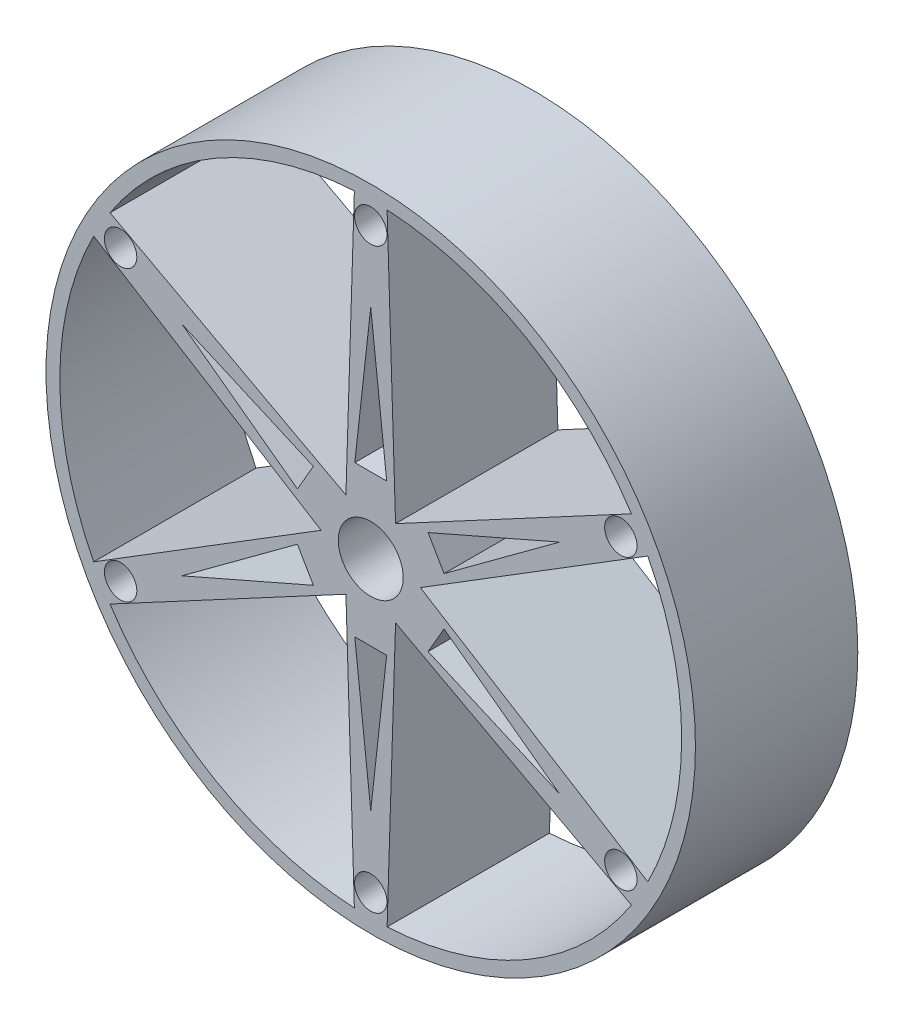
from build123d import *

# Parameters (mm, degrees)
SKETCH1_R           = 0.14979499
BOSS_EXTRUDE1_DEPTH = 1.5


with BuildPart() as part:
    # Sketch1 → Boss-Extrude1 (new body)
    # profile 1 of 26: a face of its own
    with BuildSketch(Plane.XY):
        with BuildLine():
            Line((-0.151247724, 2.868610652), (-0.147216387, 2.996385712))
            ThreePointArc((-0.147216387, 2.996385712), (-1.5, 2.598076211), (-2.521337953, 1.625685987))
            Line((-2.521337953, 1.625685987), (-2.408665836, 1.565289697))
            ThreePointArc((-2.408665836, 1.565289697), (-1.436297579, 2.487740382), (-0.151247724, 2.868610652))
        make_face()
    # profile 2 of 26: a face of its own
    with BuildSketch(Plane.XY):
        with BuildLine():
            Line((0, 2.872595159), (0, 3))
            ThreePointArc((0, 3), (-0.073630374, 2.999096292), (-0.147216387, 2.996385712))
            Line((-0.147216387, 2.996385712), (-0.151247724, 2.868610652))
            ThreePointArc((-0.151247724, 2.868610652), (-0.0756501, 2.871598859), (0, 2.872595159))
        make_face()
    # profile 3 of 26: a face of its own
    with BuildSketch(Plane.XY):
        with BuildLine():
            ThreePointArc((0.147216387, 2.996385712), (0.073630374, 2.999096292), (0, 3))
            Line((0, 3), (0, 2.872595159))
            ThreePointArc((0, 2.872595159), (0.0756501, 2.871598859), (0.151247724, 2.868610652))
            Line((0.151247724, 2.868610652), (0.147216387, 2.996385712))
        make_face()
    # profile 4 of 26: a face of its own
    with BuildSketch(Plane.XY):
        with BuildLine():
            ThreePointArc((2.521337953, 1.625685987), (1.5, 2.598076211), (0.147216387, 2.996385712))
            Line((0.147216387, 2.996385712), (0.151247724, 2.868610652))
            ThreePointArc((0.151247724, 2.868610652), (1.436297579, 2.487740382), (2.408665836, 1.565289697))
            Line((2.408665836, 1.565289697), (2.521337953, 1.625685987))
        make_face()
    # profile 5 of 26: a face of its own
    with BuildSketch(Plane.XY):
        with BuildLine():
            ThreePointArc((0.147216387, -2.996385712), (1.5, -2.598076211), (2.521337953, -1.625685987))
            Line((2.521337953, -1.625685987), (2.408665836, -1.565289697))
            ThreePointArc((2.408665836, -1.565289697), (1.436297579, -2.487740382), (0.151247724, -2.868610652))
            Line((0.151247724, -2.868610652), (0.147216387, -2.996385712))
        make_face()
    # profile 6 of 26: a face of its own
    with BuildSketch(Plane.XY):
        with BuildLine():
            ThreePointArc((2.521337953, -1.625685987), (2.598076211, -1.5), (2.66855434, -1.370699725))
            Line((2.66855434, -1.370699725), (2.55991356, -1.303320955))
            ThreePointArc((2.55991356, -1.303320955), (2.487740382, -1.436297579), (2.408665836, -1.565289697))
            Line((2.408665836, -1.565289697), (2.521337953, -1.625685987))
        make_face()
    # profile 7 of 26: a face of its own
    with BuildSketch(Plane.XY):
        with BuildLine():
            ThreePointArc((3, 0), (2.915961507, 0.705101759), (2.66855434, 1.370699725))
            Line((2.66855434, 1.370699725), (2.55991356, 1.303320955))
            ThreePointArc((2.55991356, 1.303320955), (2.793331187, 0.67015209), (2.872595159, 0))
            ThreePointArc((2.872595159, 0), (2.793331187, -0.67015209), (2.55991356, -1.303320955))
            Line((2.55991356, -1.303320955), (2.66855434, -1.370699725))
            ThreePointArc((2.66855434, -1.370699725), (2.915961507, -0.705101759), (3, 0))
        make_face()
    # profile 8 of 26: a face of its own
    with BuildSketch(Plane.XY):
        with BuildLine():
            Line((-2.408665836, -1.565289697), (-2.521337953, -1.625685987))
            ThreePointArc((-2.521337953, -1.625685987), (-1.5, -2.598076211), (-0.147216387, -2.996385712))
            Line((-0.147216387, -2.996385712), (-0.151247724, -2.868610652))
            ThreePointArc((-0.151247724, -2.868610652), (-1.436297579, -2.487740382), (-2.408665836, -1.565289697))
        make_face()
    # profile 9 of 26: a face of its own
    with BuildSketch(Plane.XY):
        with BuildLine():
            Line((-0.151247724, -2.868610652), (-0.147216387, -2.996385712))
            ThreePointArc((-0.147216387, -2.996385712), (0, -3), (0.147216387, -2.996385712))
            Line((0.147216387, -2.996385712), (0.151247724, -2.868610652))
            ThreePointArc((0.151247724, -2.868610652), (0, -2.872595159), (-0.151247724, -2.868610652))
        make_face()
    # profile 10 of 26: a face of its own
    with BuildSketch(Plane.XY):
        with BuildLine():
            Line((-2.55991356, -1.303320955), (-2.66855434, -1.370699725))
            ThreePointArc((-2.66855434, -1.370699725), (-2.598076211, -1.5), (-2.521337953, -1.625685987))
            Line((-2.521337953, -1.625685987), (-2.408665836, -1.565289697))
            ThreePointArc((-2.408665836, -1.565289697), (-2.487740382, -1.436297579), (-2.55991356, -1.303320955))
        make_face()
    # profile 11 of 26: a face of its own
    with BuildSketch(Plane.XY):
        with BuildLine():
            Line((-2.55991356, 1.303320955), (-2.66855434, 1.370699725))
            ThreePointArc((-2.66855434, 1.370699725), (-3, 0), (-2.66855434, -1.370699725))
            Line((-2.66855434, -1.370699725), (-2.55991356, -1.303320955))
            ThreePointArc((-2.55991356, -1.303320955), (-2.872595159, 0), (-2.55991356, 1.303320955))
        make_face()
    # profile 12 of 26: a face of its own
    with BuildSketch(Plane.XY):
        with BuildLine():
            ThreePointArc((2.66855434, 1.370699725), (2.598076211, 1.5), (2.521337953, 1.625685987))
            Line((2.521337953, 1.625685987), (2.408665836, 1.565289697))
            ThreePointArc((2.408665836, 1.565289697), (2.487740382, 1.436297579), (2.55991356, 1.303320955))
            Line((2.55991356, 1.303320955), (2.66855434, 1.370699725))
        make_face()
    # profile 13 of 26: a face of its own
    with BuildSketch(Plane.XY):
        with BuildLine():
            Line((-2.408665836, 1.565289697), (-2.521337953, 1.625685987))
            ThreePointArc((-2.521337953, 1.625685987), (-2.598076211, 1.5), (-2.66855434, 1.370699725))
            Line((-2.66855434, 1.370699725), (-2.55991356, 1.303320955))
            ThreePointArc((-2.55991356, 1.303320955), (-2.487740382, 1.436297579), (-2.408665836, 1.565289697))
        make_face()
    # profile 14 of 26: a face of its own
    with BuildSketch(Plane.XY):
        with BuildLine():
            Line((-0.235905833, 0.185333316), (-0.229226676, 0.397032249))
            Line((-0.229226676, 0.397032249), (-2.408665836, 1.565289697))
            ThreePointArc((-2.408665836, 1.565289697), (-2.487740382, 1.436297579), (-2.55991356, 1.303320955))
            Line((-2.55991356, 1.303320955), (-0.458453352, 0))
            Line((-0.458453352, 0), (-0.278456276, 0.111633786))
            ThreePointArc((-0.278456276, 0.111633786), (-0.259807621, 0.15), (-0.235905833, 0.185333316))
        make_face()
        with Locations((-2.31088182, 1.334188241)):
            Circle(SKETCH1_R, mode=Mode.SUBTRACT)
        Polygon((-0.530042873, 0.476011237), (-0.677259261, 0.221024975), (-1.744995763, 1.007473773), align=None, mode=Mode.SUBTRACT)
    # profile 15 of 26: a face of its own
    with BuildSketch(Plane.XY):
        with BuildLine():
            Line((-0.278456276, -0.111633786), (-0.458453352, 0))
            Line((-0.458453352, 0), (-2.55991356, -1.303320955))
            ThreePointArc((-2.55991356, -1.303320955), (-2.487740382, -1.436297579), (-2.408665836, -1.565289697))
            Line((-2.408665836, -1.565289697), (-0.229226676, -0.397032249))
            Line((-0.229226676, -0.397032249), (-0.235905833, -0.185333316))
            ThreePointArc((-0.235905833, -0.185333316), (-0.259807621, -0.15), (-0.278456276, -0.111633786))
        make_face()
        with Locations((-2.31088182, -1.334188241)):
            Circle(SKETCH1_R, mode=Mode.SUBTRACT)
        Polygon((-0.677259261, -0.221024975), (-0.530042873, -0.476011237), (-1.744995763, -1.007473773), align=None, mode=Mode.SUBTRACT)
    # profile 16 of 26: a face of its own
    with BuildSketch(Plane.XY):
        with BuildLine():
            ThreePointArc((-0.278456276, -0.111633786), (-0.3, 0), (-0.278456276, 0.111633786))
            Line((-0.278456276, 0.111633786), (-0.458453352, 0))
            Line((-0.458453352, 0), (-0.278456276, -0.111633786))
        make_face()
    # profile 17 of 26: a face of its own
    with BuildSketch(Plane.XY):
        with BuildLine():
            Line((-0.042550443, 0.296967102), (-0.229226676, 0.397032249))
            Line((-0.229226676, 0.397032249), (-0.235905833, 0.185333316))
            ThreePointArc((-0.235905833, 0.185333316), (-0.15, 0.259807621), (-0.042550443, 0.296967102))
        make_face()
    # profile 18 of 26: a face of its own
    with BuildSketch(Plane.XY):
        with BuildLine():
            ThreePointArc((0.151247724, 2.868610652), (0.0756501, 2.871598859), (0, 2.872595159))
            Line((0, 2.872595159), (0, 2.818171471))
            ThreePointArc((0, 2.818171471), (0.105921053, 2.774297535), (0.14979499, 2.668376482))
            ThreePointArc((0.14979499, 2.668376482), (0.105921053, 2.562455429), (0, 2.518581492))
            Line((0, 2.518581492), (0, 2.014947547))
            Line((0, 2.014947547), (0.147216387, 0.697036212))
            Line((0.147216387, 0.697036212), (0, 0.697036212))
            Line((0, 0.697036212), (0, 0.3))
            ThreePointArc((0, 0.3), (0.021329198, 0.299240815), (0.042550443, 0.296967102))
            Line((0.042550443, 0.296967102), (0.229226676, 0.397032249))
            Line((0.229226676, 0.397032249), (0.151247724, 2.868610652))
        make_face()
    # profile 19 of 26: a face of its own
    with BuildSketch(Plane.XY):
        with BuildLine():
            Line((0, 2.818171471), (0, 2.872595159))
            ThreePointArc((0, 2.872595159), (-0.0756501, 2.871598859), (-0.151247724, 2.868610652))
            Line((-0.151247724, 2.868610652), (-0.229226676, 0.397032249))
            Line((-0.229226676, 0.397032249), (-0.042550443, 0.296967102))
            ThreePointArc((-0.042550443, 0.296967102), (-0.021329198, 0.299240815), (0, 0.3))
            Line((0, 0.3), (0, 0.697036212))
            Line((0, 0.697036212), (-0.147216387, 0.697036212))
            Line((-0.147216387, 0.697036212), (0, 2.014947547))
            Line((0, 2.014947547), (0, 2.518581492))
            ThreePointArc((0, 2.518581492), (-0.14979499, 2.668376482), (0, 2.818171471))
        make_face()
    # profile 20 of 26: a face of its own
    with BuildSketch(Plane.XY):
        with BuildLine():
            Line((0.235905833, 0.185333316), (0.229226676, 0.397032249))
            Line((0.229226676, 0.397032249), (0.042550443, 0.296967102))
            ThreePointArc((0.042550443, 0.296967102), (0.15, 0.259807621), (0.235905833, 0.185333316))
        make_face()
    # profile 21 of 26: a face of its own
    with BuildSketch(Plane.XY):
        with BuildLine():
            Line((2.408665836, 1.565289697), (0.229226676, 0.397032249))
            Line((0.229226676, 0.397032249), (0.235905833, 0.185333316))
            ThreePointArc((0.235905833, 0.185333316), (0.259807621, 0.15), (0.278456276, 0.111633786))
            Line((0.278456276, 0.111633786), (0.458453352, 0))
            Line((0.458453352, 0), (2.55991356, 1.303320955))
            ThreePointArc((2.55991356, 1.303320955), (2.487740382, 1.436297579), (2.408665836, 1.565289697))
        make_face()
        Polygon((0.677259261, 0.221024975), (0.530042873, 0.476011237), (1.744995763, 1.007473773), align=None, mode=Mode.SUBTRACT)
        with Locations((2.31088182, 1.334188241)):
            Circle(SKETCH1_R, mode=Mode.SUBTRACT)
    # profile 22 of 26: a face of its own
    with BuildSketch(Plane.XY):
        with BuildLine():
            Line((0.458453352, 0), (0.278456276, 0.111633786))
            ThreePointArc((0.278456276, 0.111633786), (0.294564834, 0.056846799), (0.3, 0))
            ThreePointArc((0.3, 0), (0.294564834, -0.056846799), (0.278456276, -0.111633786))
            Line((0.278456276, -0.111633786), (0.458453352, 0))
        make_face()
    # profile 23 of 26: a face of its own
    with BuildSketch(Plane.XY):
        with BuildLine():
            Line((2.55991356, -1.303320955), (0.458453352, 0))
            Line((0.458453352, 0), (0.278456276, -0.111633786))
            ThreePointArc((0.278456276, -0.111633786), (0.259807621, -0.15), (0.235905833, -0.185333316))
            Line((0.235905833, -0.185333316), (0.229226676, -0.397032249))
            Line((0.229226676, -0.397032249), (2.408665836, -1.565289697))
            ThreePointArc((2.408665836, -1.565289697), (2.487740382, -1.436297579), (2.55991356, -1.303320955))
        make_face()
        Polygon((0.530042873, -0.476011237), (0.677259261, -0.221024975), (1.744995763, -1.007473773), align=None, mode=Mode.SUBTRACT)
        with Locations((2.31088182, -1.334188241)):
            Circle(SKETCH1_R, mode=Mode.SUBTRACT)
    # profile 24 of 26: a face of its own
    with BuildSketch(Plane.XY):
        with BuildLine():
            Line((0.229226676, -0.397032249), (0.235905833, -0.185333316))
            ThreePointArc((0.235905833, -0.185333316), (0.15, -0.259807621), (0.042550443, -0.296967102))
            Line((0.042550443, -0.296967102), (0.229226676, -0.397032249))
        make_face()
    # profile 25 of 26: a face of its own
    with BuildSketch(Plane.XY):
        with BuildLine():
            Line((-0.042550443, -0.296967102), (-0.229226676, -0.397032249))
            Line((-0.229226676, -0.397032249), (-0.151247724, -2.868610652))
            ThreePointArc((-0.151247724, -2.868610652), (0, -2.872595159), (0.151247724, -2.868610652))
            Line((0.151247724, -2.868610652), (0.229226676, -0.397032249))
            Line((0.229226676, -0.397032249), (0.042550443, -0.296967102))
            ThreePointArc((0.042550443, -0.296967102), (0, -0.3), (-0.042550443, -0.296967102))
        make_face()
        with Locations((0, -2.668376482)):
            Circle(SKETCH1_R, mode=Mode.SUBTRACT)
        Polygon((-0.147216387, -0.697036212), (0.147216387, -0.697036212), (0, -2.014947547), align=None, mode=Mode.SUBTRACT)
    # profile 26 of 26: a face of its own
    with BuildSketch(Plane.XY):
        with BuildLine():
            ThreePointArc((-0.042550443, -0.296967102), (-0.15, -0.259807621), (-0.235905833, -0.185333316))
            Line((-0.235905833, -0.185333316), (-0.229226676, -0.397032249))
            Line((-0.229226676, -0.397032249), (-0.042550443, -0.296967102))
        make_face()
    extrude(amount=BOSS_EXTRUDE1_DEPTH)


solid = part.part
